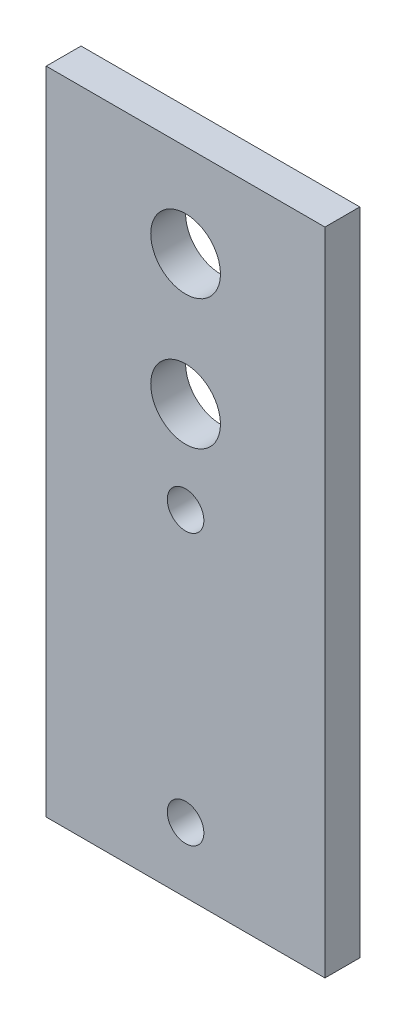
from build123d import *

# Parameters (mm, degrees)
SKETCH1_W           = 38.1
SKETCH1_H           = 88.9
SKETCH1_R           = 2.5
SKETCH1_R_2         = 4.7625
BOSS_EXTRUDE1_DEPTH = 4.7625


with BuildPart() as part:
    # Sketch1 → Boss-Extrude1 (new body)
    with BuildSketch(Plane.XY):
        with Locations((19.05, 44.45)):
            Rectangle(SKETCH1_W, SKETCH1_H)
        with Locations(Location((19.05, 8.89, 0), (0, 0, 180))):
            Circle(SKETCH1_R, mode=Mode.SUBTRACT)
        with Locations(Location((19.05, 45.89, 0), (0, 0, 180))):
            Circle(SKETCH1_R, mode=Mode.SUBTRACT)
        with Locations(Location((19.05, 76.2, 0), (0, 0, 180))):
            Circle(SKETCH1_R_2, mode=Mode.SUBTRACT)
        with Locations(Location((19.05, 58.42, 0), (0, 0, 180))):
            Circle(SKETCH1_R_2, mode=Mode.SUBTRACT)
    extrude(amount=BOSS_EXTRUDE1_DEPTH)


solid = part.part
